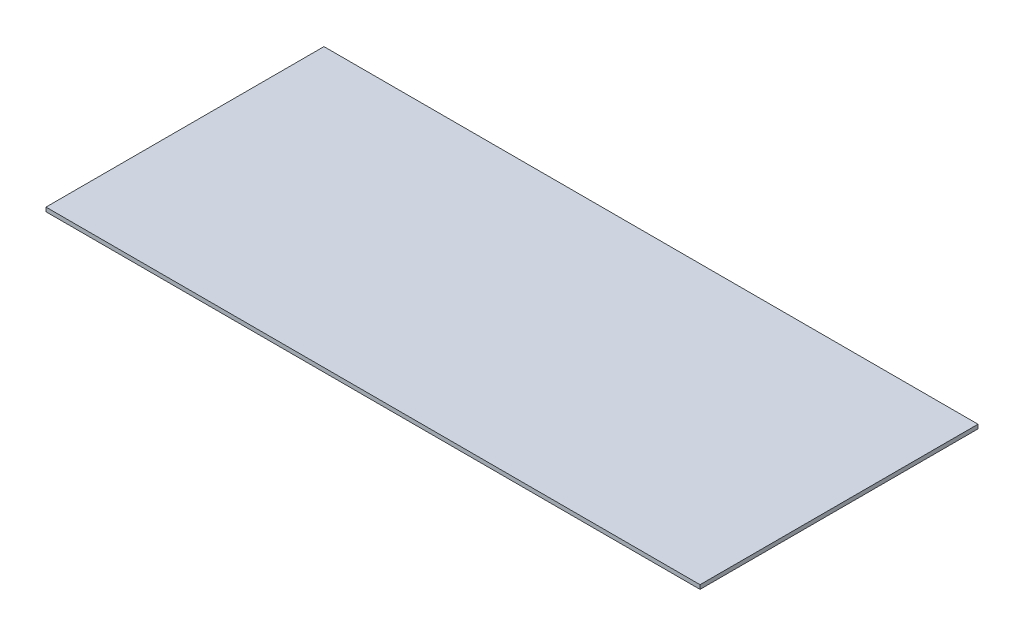
from build123d import *

# Parameters (mm, degrees)
SKETCH2_W           = 508
SKETCH2_H           = 215.9
BOSS_EXTRUDE2_DEPTH = 3.175


with BuildPart() as part:
    # Sketch2 → Boss-Extrude2 (new body)
    with BuildSketch(Plane(origin=(0, 0, 0), x_dir=(1, 0, 0), z_dir=(0, 1, 0))):
        Rectangle(SKETCH2_W, SKETCH2_H)
    extrude(amount=BOSS_EXTRUDE2_DEPTH)


solid = part.part
